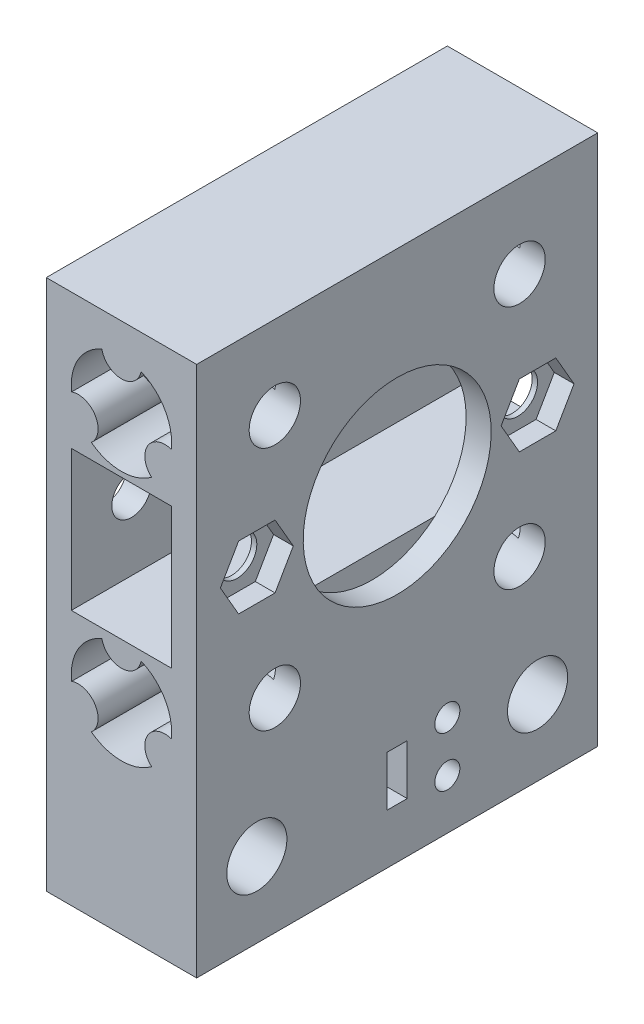
from build123d import *

# Parameters (mm, degrees)
SKETCH1_W           = 19.05
SKETCH1_H           = 57.15
BOSS_EXTRUDE1_DEPTH = 50.8
SKETCH1_4_R         = 6.35
CUT_EXTRUDE1_DEPTH  = 60.05841388
SKETCH1_5_R         = 2.54
BOSS_EXTRUDE2_DEPTH = 50.8
SKETCH1_6_R         = 6.35
CUT_EXTRUDE2_DEPTH  = 60.05841388
SKETCH1_7_R         = 2.54
BOSS_EXTRUDE3_DEPTH = 50.8
SKETCH4_R           = 8.5
CUT_EXTRUDE3_DEPTH  = 62.319435133
SKETCH4_3_R         = 11
CUT_EXTRUDE4_DEPTH  = 2.5
SKETCH5_W           = 12.7
SKETCH5_H           = 17.78
CUT_EXTRUDE5_DEPTH  = 60.05841388
SKETCH4_4_R         = 1.7
CUT_EXTRUDE6_DEPTH  = 62.319435133
SKETCH6_R           = 3.25
CUT_EXTRUDE7_DEPTH  = 17.78
CUT_EXTRUDE8_DEPTH  = 2.5
CUT_EXTRUDE9_DEPTH  = 2.5
SKETCH9_R           = 2.499999953
SKETCH9_R_2         = 2.5
CUT_EXTRUDE10_DEPTH = 61.589381373
SKETCH10_R          = 11.90625
CUT_EXTRUDE11_DEPTH = 3.175
SKETCH11_W          = 19.05
SKETCH11_H          = 50.8
CUT_EXTRUDE12_DEPTH = 2.54
SKETCH12_W          = 19.05
SKETCH12_H          = 50.8
BOSS_EXTRUDE4_DEPTH = 12.7
SKETCH13_R          = 3.81
CUT_EXTRUDE15_DEPTH = 69.170141082
SKETCH13_6_W        = 2.54
SKETCH13_6_H        = 6.35
CUT_EXTRUDE16_DEPTH = 69.170141082
SKETCH13_7_R        = 1.5875
CUT_EXTRUDE17_DEPTH = 69.170141082


with BuildPart() as part:
    # Sketch1 → Boss-Extrude1 (new body)
    with BuildSketch(Plane.XY):
        Rectangle(SKETCH1_W, SKETCH1_H)
    extrude(amount=BOSS_EXTRUDE1_DEPTH)

    # Sketch1<4> → Cut-Extrude1 (cut, through all)
    with BuildSketch(Plane.XY):
        with Locations((0, -15.875)):
            Circle(SKETCH1_4_R)
    extrude(amount=CUT_EXTRUDE1_DEPTH, mode=Mode.SUBTRACT)

    # Sketch1<5> → Boss-Extrude2 (add, through all)
    with BuildSketch(Plane.XY):
        with Locations((0, -9.525)):
            Circle(SKETCH1_5_R)
        with Locations((5.499261314, -19.05)):
            Circle(SKETCH1_5_R)
        with Locations((-5.499261314, -19.05)):
            Circle(SKETCH1_5_R)
    extrude(amount=BOSS_EXTRUDE2_DEPTH)

    # Sketch1<6> → Cut-Extrude2 (cut, through all)
    with BuildSketch(Plane.XY):
        with Locations((0, 15.875)):
            Circle(SKETCH1_6_R)
    extrude(amount=CUT_EXTRUDE2_DEPTH, mode=Mode.SUBTRACT)

    # Sketch1<7> → Boss-Extrude3 (add, through all)
    with BuildSketch(Plane.XY):
        with Locations((0, 22.225)):
            Circle(SKETCH1_7_R)
        with Locations((5.499261314, 12.7)):
            Circle(SKETCH1_7_R)
        with Locations((-5.499261314, 12.7)):
            Circle(SKETCH1_7_R)
    extrude(amount=BOSS_EXTRUDE3_DEPTH)

    # Sketch4 → Cut-Extrude3 (cut, through all)
    with BuildSketch(Plane.ZY.offset(9.525)):
        with Locations(Location((25.4, 0, 0), (0, 0, 270))):
            Circle(SKETCH4_R)
    extrude(amount=-CUT_EXTRUDE3_DEPTH, mode=Mode.SUBTRACT)

    # Sketch4<3> → Cut-Extrude4 (cut)
    with BuildSketch(Plane.ZY.offset(9.525)):
        with Locations(Location((25.4, 0, 0), (0, 0, 270))):
            Circle(SKETCH4_3_R)
    extrude(amount=-CUT_EXTRUDE4_DEPTH, mode=Mode.SUBTRACT)

    # Sketch5 → Cut-Extrude5 (cut, through all)
    with BuildSketch(Plane(origin=(0, 0, 0), x_dir=(-1, 0, 0), z_dir=(0, 0, -1))):
        Rectangle(SKETCH5_W, SKETCH5_H)
    extrude(amount=-CUT_EXTRUDE5_DEPTH, mode=Mode.SUBTRACT)

    # Sketch4<4> → Cut-Extrude6 (cut, through all)
    with BuildSketch(Plane.ZY.offset(9.525)):
        with Locations(Location((9.9, 15.5, 0), (0, 0, 270))):
            Circle(SKETCH4_4_R)
        with Locations(Location((40.9, 15.5, 0), (0, 0, 270))):
            Circle(SKETCH4_4_R)
        with Locations(Location((40.9, -15.5, 0), (0, 0, 270))):
            Circle(SKETCH4_4_R)
        with Locations(Location((9.9, -15.5, 0), (0, 0, 270))):
            Circle(SKETCH4_4_R)
    extrude(amount=-CUT_EXTRUDE6_DEPTH, mode=Mode.SUBTRACT)

    # Sketch6 → Cut-Extrude7 (cut)
    with BuildSketch(Plane(origin=(9.525, 0, 0), x_dir=(0, 0, -1), z_dir=(1, 0, 0))):
        with Locations(Location((-40.9, 15.5, 0), (0, 0, 90))):
            Circle(SKETCH6_R)
        with Locations(Location((-9.9, 15.5, 0), (0, 0, 90))):
            Circle(SKETCH6_R)
        with Locations(Location((-9.9, -15.5, 0), (0, 0, 90))):
            Circle(SKETCH6_R)
        with Locations(Location((-40.9, -15.5, 0), (0, 0, 90))):
            Circle(SKETCH6_R)
    extrude(amount=-CUT_EXTRUDE7_DEPTH, mode=Mode.SUBTRACT)

    # Sketch7 → Cut-Extrude8 (cut)
    with BuildSketch(Plane(origin=(9.525, 0, 0), x_dir=(0, 0, -1), z_dir=(1, 0, 0))):
        Polygon((-47.798802154, 0), (-45.489401077, -4), (-40.870598923, -4), (-38.561197846, 0), (-40.870598923, 4), (-45.489401077, 4), align=None)
    extrude(amount=-CUT_EXTRUDE8_DEPTH, mode=Mode.SUBTRACT)

    # Sketch7<3> → Cut-Extrude9 (cut)
    with BuildSketch(Plane(origin=(9.525, 0, 0), x_dir=(0, 0, -1), z_dir=(1, 0, 0))):
        Polygon((-12.238802154, 0), (-9.929401077, -4), (-5.310598923, -4), (-3.001197846, 0), (-5.310598923, 4), (-9.929401077, 4), align=None)
    extrude(amount=-CUT_EXTRUDE9_DEPTH, mode=Mode.SUBTRACT)

    # Sketch9 → Cut-Extrude10 (cut, through all)
    with BuildSketch(Plane(origin=(7.025, 0, 0), x_dir=(0, 0, -1), z_dir=(1, 0, 0))):
        with Locations((-43.18, 0)):
            Circle(SKETCH9_R)
        with Locations((-7.62, 0)):
            Circle(SKETCH9_R_2)
    extrude(amount=-CUT_EXTRUDE10_DEPTH, mode=Mode.SUBTRACT)

    # Sketch10 → Cut-Extrude11 (cut)
    with BuildSketch(Plane(origin=(9.525, 0, 0), x_dir=(0, 0, -1), z_dir=(1, 0, 0))):
        with Locations(Location((-25.4, 0, 0), (0, 0, 90))):
            Circle(SKETCH10_R)
    extrude(amount=-CUT_EXTRUDE11_DEPTH, mode=Mode.SUBTRACT)

    # Sketch11 → Cut-Extrude12 (cut)
    with BuildSketch(Plane(origin=(0, 28.575, 0), x_dir=(1, 0, 0), z_dir=(0, 1, 0))):
        with Locations((0, -25.4)):
            Rectangle(SKETCH11_W, SKETCH11_H)
    extrude(amount=-CUT_EXTRUDE12_DEPTH, mode=Mode.SUBTRACT)

    # Sketch12 → Boss-Extrude4 (add)
    with BuildSketch(Plane.XZ.offset(28.575)):
        with Locations((0, 25.4)):
            Rectangle(SKETCH12_W, SKETCH12_H)
    extrude(amount=BOSS_EXTRUDE4_DEPTH)

    # Sketch13 → Cut-Extrude15 (cut, through all)
    with BuildSketch(Plane(origin=(9.525, 0, 0), x_dir=(0, 0, -1), z_dir=(1, 0, 0))):
        with Locations(Location((-43.18, -31.75, 0), (0, 0, 90))):
            Circle(SKETCH13_R)
        with Locations(Location((-7.62, -31.75, 0), (0, 0, 90))):
            Circle(SKETCH13_R)
    extrude(amount=-CUT_EXTRUDE15_DEPTH, mode=Mode.SUBTRACT)

    # Sketch13<6> → Cut-Extrude16 (cut, through all)
    with BuildSketch(Plane(origin=(9.525, 0, 0), x_dir=(0, 0, -1), z_dir=(1, 0, 0))):
        with Locations((-25.4, -31.75)):
            Rectangle(SKETCH13_6_W, SKETCH13_6_H)
    extrude(amount=-CUT_EXTRUDE16_DEPTH, mode=Mode.SUBTRACT)

    # Sketch13<7> → Cut-Extrude17 (cut, through all)
    with BuildSketch(Plane(origin=(9.525, 0, 0), x_dir=(0, 0, -1), z_dir=(1, 0, 0))):
        with Locations(Location((-19.05, -28.575, 0), (0, 0, 90))):
            Circle(SKETCH13_7_R)
        with Locations(Location((-19.05, -34.925, 0), (0, 0, 90))):
            Circle(SKETCH13_7_R)
    extrude(amount=-CUT_EXTRUDE17_DEPTH, mode=Mode.SUBTRACT)


solid = part.part
